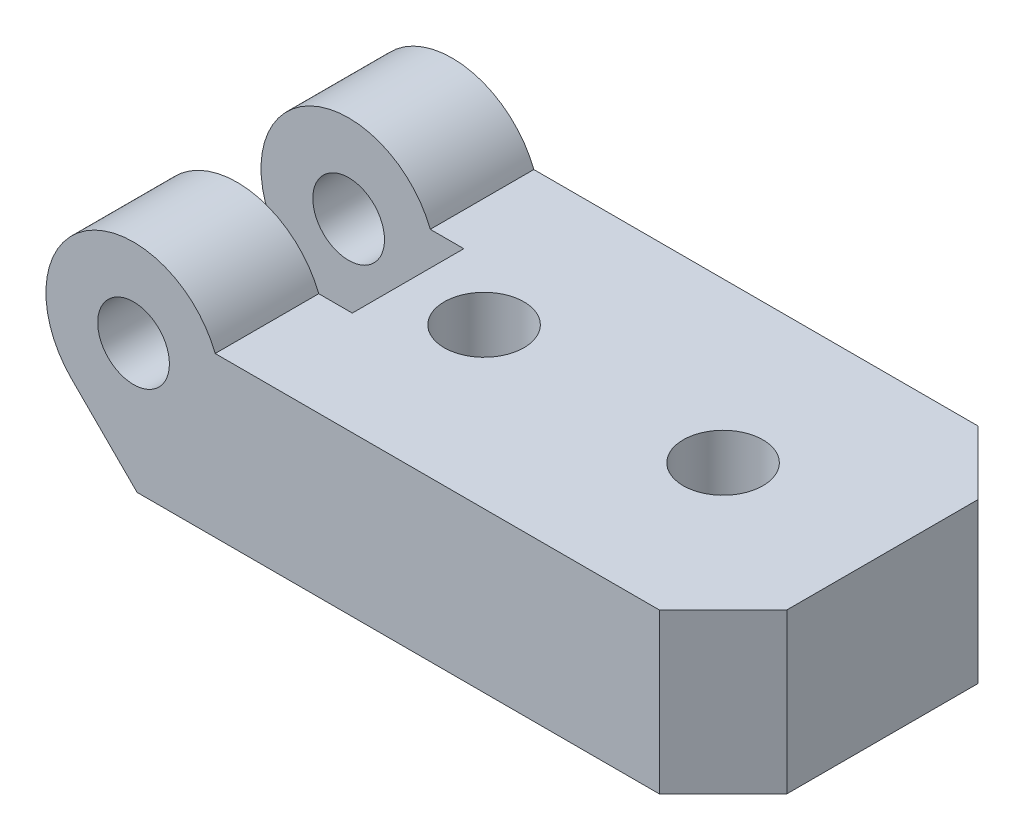
from build123d import *

# Parameters (mm, degrees)
SKETCH1_W           = 35
SKETCH1_H           = 20
SKETCH1_R           = 2.5
BOSS_EXTRUDE1_DEPTH = 10
BOSS_EXTRUDE2_DEPTH = 6.5
SKETCH3_R           = 7.5
CUT_EXTRUDE1_DEPTH  = 7
SKETCH4_R           = 2.25
CUT_EXTRUDE2_DEPTH  = 49.872282533
CHAMFER1_SIZE       = 4


with BuildPart() as part:
    # Sketch1 → Boss-Extrude1 (new body)
    with BuildSketch(Plane(origin=(0, 0, 0), x_dir=(1, 0, 0), z_dir=(0, 1, 0))):
        with Locations((-17.5, 0)):
            Rectangle(SKETCH1_W, SKETCH1_H)
        with Locations(Location((-10, 0, 0), (0, 0, 270))):
            Circle(SKETCH1_R, mode=Mode.SUBTRACT)
        with Locations(Location((-25, 0, 0), (0, 0, 270))):
            Circle(SKETCH1_R, mode=Mode.SUBTRACT)
    extrude(amount=BOSS_EXTRUDE1_DEPTH)

    # Sketch2 → Boss-Extrude2 (add)
    with BuildSketch(Plane.XY.offset(10)):
        with BuildLine():
            Line((-35, 0), (-36.778174593, 0))
            Line((-36.778174593, 0), (-40.889087297, 4.110912703))
            ThreePointArc((-40.889087297, 4.110912703), (-35.871686573, 13.383020417), (-35, 2.876524617))
            Line((-35, 2.876524617), (-35, 0))
        make_face()
    boss_extrude2 = extrude(amount=-BOSS_EXTRUDE2_DEPTH)

    # Mirror1: Boss-Extrude2 across plane
    add(boss_extrude2.mirror(Plane.XY))

    # Sketch3 → Cut-Extrude1 (cut)
    with BuildSketch(Plane.XY.offset(-3.5)):
        with Locations((-37, 8)):
            Circle(SKETCH3_R)
    extrude(amount=CUT_EXTRUDE1_DEPTH, mode=Mode.SUBTRACT)

    # Sketch4 → Cut-Extrude2 (cut, through all)
    with BuildSketch(Plane.XY.offset(10)):
        with Locations((-37, 8)):
            Circle(SKETCH4_R)
    extrude(amount=-CUT_EXTRUDE2_DEPTH, mode=Mode.SUBTRACT)

    # Chamfer1
    chamfer1_edges = [part.edges().sort_by_distance(p)[0] for p in [
        (0, 5, -10),
        (0, 5, 10),
    ]]
    chamfer(chamfer1_edges, length=CHAMFER1_SIZE)


solid = part.part
